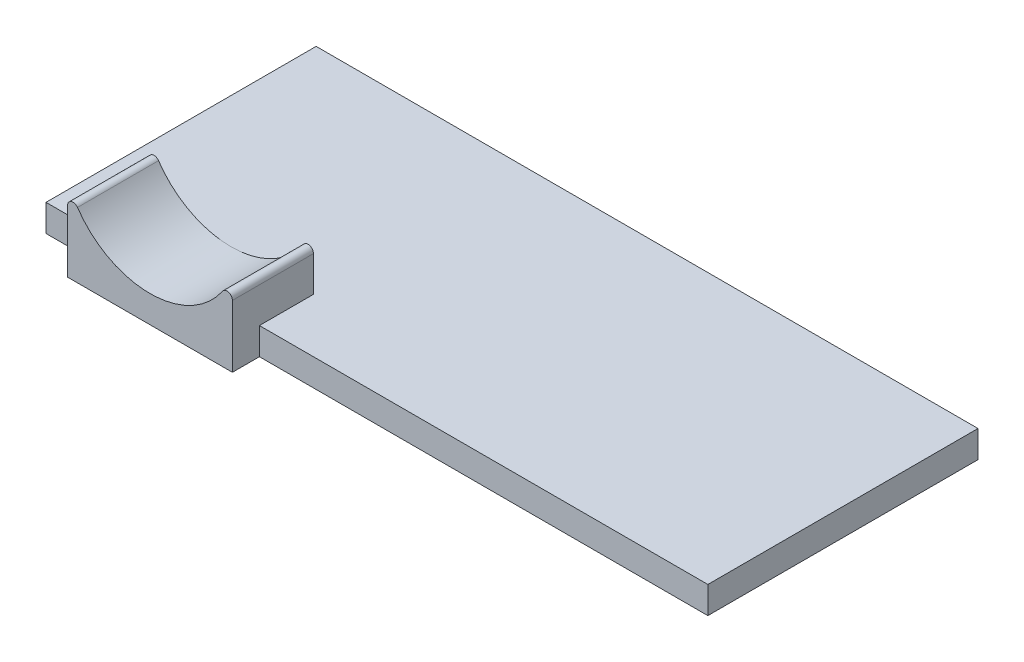
from build123d import *

# Parameters (mm, degrees)
SKETCH1_W           = 24.5
SKETCH1_H           = 10
BOSS_EXTRUDE1_DEPTH = 1
SKETCH2_W           = 6.1
SKETCH2_H           = 3
BOSS_EXTRUDE2_DEPTH = 3.25
SKETCH4_W           = 6.1
SKETCH4_H           = 1
BOSS_EXTRUDE3_DEPTH = 1
SKETCH3_R           = 3.25
CUT_EXTRUDE1_DEPTH  = 3
FILLET1_R           = 0.2


with BuildPart() as part:
    # Sketch1 → Boss-Extrude1 (new body)
    with BuildSketch(Plane(origin=(0, 0, 0), x_dir=(1, 0, 0), z_dir=(0, 1, 0))):
        with Locations((-12.25, 5)):
            Rectangle(SKETCH1_W, SKETCH1_H)
    extrude(amount=BOSS_EXTRUDE1_DEPTH)

    # Sketch2 → Boss-Extrude2 (add)
    with BuildSketch(Plane(origin=(0, 1, 0), x_dir=(1, 0, 0), z_dir=(0, 1, 0))):
        with Locations((-19.65, 0.5)):
            Rectangle(SKETCH2_W, SKETCH2_H)
    extrude(amount=BOSS_EXTRUDE2_DEPTH)

    # Sketch4 → Boss-Extrude3 (add)
    with BuildSketch(Plane(origin=(0, 1, 0), x_dir=(-1, 0, 0), z_dir=(0, -1, 0))):
        with Locations((19.65, -0.5)):
            Rectangle(SKETCH4_W, SKETCH4_H)
    extrude(amount=BOSS_EXTRUDE3_DEPTH)

    # Sketch3 → Cut-Extrude1 (cut)
    with BuildSketch(Plane.XY.offset(1)):
        with Locations((-19.65, 4.25)):
            Circle(SKETCH3_R)
    extrude(amount=-CUT_EXTRUDE1_DEPTH, mode=Mode.SUBTRACT)

    # Fillet1
    fillet1_edges = [part.edges().sort_by_distance(p)[0] for p in [
        (-16.6, 3.127502784, -0.5),
        (-22.7, 3.127502784, -0.5),
    ]]
    fillet(fillet1_edges, radius=FILLET1_R)


solid = part.part
